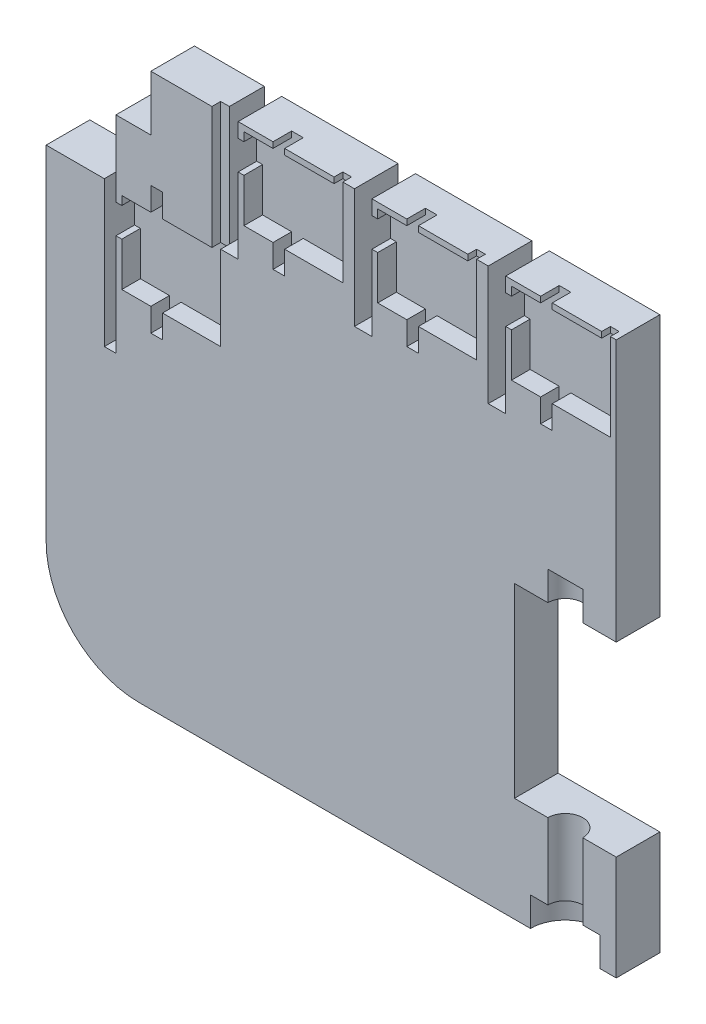
from build123d import *

# Parameters (mm, degrees)
BOSS_EXTRUDE1_DEPTH = 7.5
CUT_EXTRUDE1_DEPTH  = 3.2
CUT_EXTRUDE2_DEPTH  = 5
CUT_EXTRUDE3_DEPTH  = 50
CUT_EXTRUDE4_REACH  = 70.655
SKETCH5_W           = 3
SKETCH5_H           = 17
CUT_EXTRUDE5_REACH  = 70.655
SKETCH8_W           = 12
SKETCH8_H           = 37
CUT_EXTRUDE6_DEPTH  = 3.2
SKETCH10_W          = 10
SKETCH10_H          = 7.5
BOSS_EXTRUDE2_DEPTH = 17
SKETCH11_W          = 3
SKETCH11_H          = 7.5
CUT_EXTRUDE7_DEPTH  = 3.5
SKETCH12_W          = 2
SKETCH12_H          = 7.5
CUT_EXTRUDE8_DEPTH  = 4
SKETCH13_W          = 2
SKETCH13_H          = 7.5
CUT_EXTRUDE9_DEPTH  = 4
SKETCH14_W          = 7.5
SKETCH14_H          = 9.5
CUT_EXTRUDE10_DEPTH = 6
SKETCH15_W          = 1.5
SKETCH15_H          = 21
SKETCH15_H_2        = 1
CUT_EXTRUDE11_DEPTH = 1.5


with BuildPart() as part:
    # Sketch1 → Boss-Extrude1 (new body)
    with BuildSketch(Plane.XY):
        with BuildLine():
            Line((-33, -47.5), (49, -47.5))
            Line((49, -47.5), (49, -29.5))
            Line((49, -29.5), (31.5, -29.5))
            Line((31.5, -29.5), (31.5, 2.5))
            Line((31.5, 2.5), (49, 2.5))
            Line((49, 2.5), (49, 47.5))
            Line((49, 47.5), (30, 47.5))
            Line((30, 47.5), (30, 30.5))
            Line((30, 30.5), (27, 30.5))
            Line((27, 30.5), (27, 47.5))
            Line((27, 47.5), (-49, 47.5))
            Line((-49, 47.5), (-49, -31.5))
            ThreePointArc((-49, -31.5), (-44.313708499, -42.813708499), (-33, -47.5))
        make_face()
    extrude(amount=BOSS_EXTRUDE1_DEPTH)

    # Sketch2 → Cut-Extrude1 (cut)
    with BuildSketch(Plane.XY.offset(7.5)):
        Polygon((30, 40), (31, 40), (31, 32.5), (36, 32.5), (36, 28.5), (38, 28.5), (38, 32.5), (48, 32.5), (48, 46.5), (38, 46.5), (38, 47.5), (36, 47.5), (36, 46.5), (31, 46.5), (31, 45), (30, 45), align=None)
        Polygon((-16, 40), (-15, 40), (-15, 32.5), (-10, 32.5), (-10, 28.5), (-8, 28.5), (-8, 32.5), (2, 32.5), (2, 46.5), (-8, 46.5), (-8, 47.5), (-10, 47.5), (-10, 46.5), (-15, 46.5), (-15, 45), (-16, 45), align=None)
        Polygon((7, 40), (8, 40), (8, 32.5), (13, 32.5), (13, 28.5), (15, 28.5), (15, 32.5), (25, 32.5), (25, 46.5), (15, 46.5), (15, 47.5), (13, 47.5), (13, 46.5), (8, 46.5), (8, 45), (7, 45), align=None)
    extrude(amount=-CUT_EXTRUDE1_DEPTH, mode=Mode.SUBTRACT)

    # Sketch3 → Cut-Extrude2 (cut)
    with BuildSketch(Plane.XZ.offset(47.5)):
        with BuildLine():
            Line((34.25, 7.5), (46.25, 7.5))
            ThreePointArc((46.25, 7.5), (40.25, 1.5), (34.25, 7.5))
        make_face()
    extrude(amount=-CUT_EXTRUDE2_DEPTH, mode=Mode.SUBTRACT)

    # Sketch4 → Cut-Extrude3 (cut)
    with BuildSketch(Plane.XZ.offset(42.5)):
        with BuildLine():
            Line((37.25, 7.5), (43.25, 7.5))
            ThreePointArc((43.25, 7.5), (40.25, 4.5), (37.25, 7.5))
        make_face()
    extrude(amount=-CUT_EXTRUDE3_DEPTH, mode=Mode.SUBTRACT)

    # Sketch5 → Cut-Extrude4 (cut, up to next)
    with BuildSketch(Plane.XY.offset(7.5), mode=Mode.PRIVATE) as cut_extrude4_sk1:
        with Locations((5.5, 39)):
            Rectangle(SKETCH5_W, SKETCH5_H)
    cut_extrude4_tool1 = extrude(cut_extrude4_sk1.sketch, amount=-CUT_EXTRUDE4_REACH, mode=Mode.PRIVATE) & part.part
    # Sketch5 → Cut-Extrude4 (cut, up to next)
    with BuildSketch(Plane.XY.offset(7.5), mode=Mode.PRIVATE) as cut_extrude4_sk2:
        with Locations((-17.5, 39)):
            Rectangle(SKETCH5_W, SKETCH5_H)
    cut_extrude4_tool2 = extrude(cut_extrude4_sk2.sketch, amount=-CUT_EXTRUDE4_REACH, mode=Mode.PRIVATE) & part.part
    add(cut_extrude4_tool1.solids().sort_by_distance((5.5, 39, 7.5))[0], mode=Mode.SUBTRACT)
    add(cut_extrude4_tool2.solids().sort_by_distance((-17.5, 39, 7.5))[0], mode=Mode.SUBTRACT)

    # Sketch8 → Cut-Extrude5 (cut, up to next)
    with BuildSketch(Plane.XY.offset(7.5), mode=Mode.PRIVATE) as cut_extrude5_sk1:
        with Locations((-43, 29)):
            Rectangle(SKETCH8_W, SKETCH8_H)
    cut_extrude5_tool1 = extrude(cut_extrude5_sk1.sketch, amount=-CUT_EXTRUDE5_REACH, mode=Mode.PRIVATE) & part.part
    add(cut_extrude5_tool1.solids().sort_by_distance((-43, 29, 7.5))[0], mode=Mode.SUBTRACT)

    # Sketch9 → Cut-Extrude6 (cut)
    with BuildSketch(Plane.XY.offset(7.5)):
        Polygon((-37, 20), (-36, 20), (-36, 12.5), (-31, 12.5), (-31, 8.5), (-29, 8.5), (-29, 12.5), (-19, 12.5), (-19, 26.5), (-29, 26.5), (-29, 30.5), (-31, 30.5), (-31, 26.5), (-36, 26.5), (-36, 25), (-37, 25), align=None)
    extrude(amount=-CUT_EXTRUDE6_DEPTH, mode=Mode.SUBTRACT)

    # Sketch10 → Boss-Extrude2 (add)
    with BuildSketch(Plane(origin=(0, 10.5, 0), x_dir=(1, 0, 0), z_dir=(0, 1, 0))):
        with Locations((-44, -3.75)):
            Rectangle(SKETCH10_W, SKETCH10_H)
    extrude(amount=BOSS_EXTRUDE2_DEPTH)

    # Sketch11 → Cut-Extrude7 (cut)
    with BuildSketch(Plane(origin=(0, 30.5, 0), x_dir=(1, 0, 0), z_dir=(0, 1, 0))):
        with Locations((-17.5, -3.75)):
            Rectangle(SKETCH11_W, SKETCH11_H)
        with Locations((5.5, -3.75)):
            Rectangle(SKETCH11_W, SKETCH11_H)
        with Locations((28.5, -3.75)):
            Rectangle(SKETCH11_W, SKETCH11_H)
    extrude(amount=-CUT_EXTRUDE7_DEPTH, mode=Mode.SUBTRACT)

    # Sketch12 → Cut-Extrude8 (cut)
    with BuildSketch(Plane(origin=(0, 10.5, 0), x_dir=(1, 0, 0), z_dir=(0, 1, 0))):
        with Locations((-38, -3.75)):
            Rectangle(SKETCH12_W, SKETCH12_H)
    extrude(amount=-CUT_EXTRUDE8_DEPTH, mode=Mode.SUBTRACT)

    # Sketch13 → Cut-Extrude9 (cut)
    with BuildSketch(Plane(origin=(0, 6.5, 0), x_dir=(1, 0, 0), z_dir=(0, 1, 0))):
        with Locations((-38, -3.75)):
            Rectangle(SKETCH13_W, SKETCH13_H)
    extrude(amount=-CUT_EXTRUDE9_DEPTH, mode=Mode.SUBTRACT)

    # Sketch14 → Cut-Extrude10 (cut)
    with BuildSketch(Plane.ZY.offset(37)):
        with Locations((3.75, 42.75)):
            Rectangle(SKETCH14_W, SKETCH14_H)
    extrude(amount=-CUT_EXTRUDE10_DEPTH, mode=Mode.SUBTRACT)

    # Sketch15 → Cut-Extrude11 (cut)
    with BuildSketch(Plane.XY.offset(7.5)):
        with Locations((-19.75, 37)):
            Rectangle(SKETCH15_W, SKETCH15_H)
        with Locations((1.25, 47)):
            Rectangle(SKETCH15_W, SKETCH15_H_2)
        with Locations((24.25, 47)):
            Rectangle(SKETCH15_W, SKETCH15_H_2)
        with Locations((47.25, 47)):
            Rectangle(SKETCH15_W, SKETCH15_H_2)
    extrude(amount=-CUT_EXTRUDE11_DEPTH, mode=Mode.SUBTRACT)


solid = part.part
